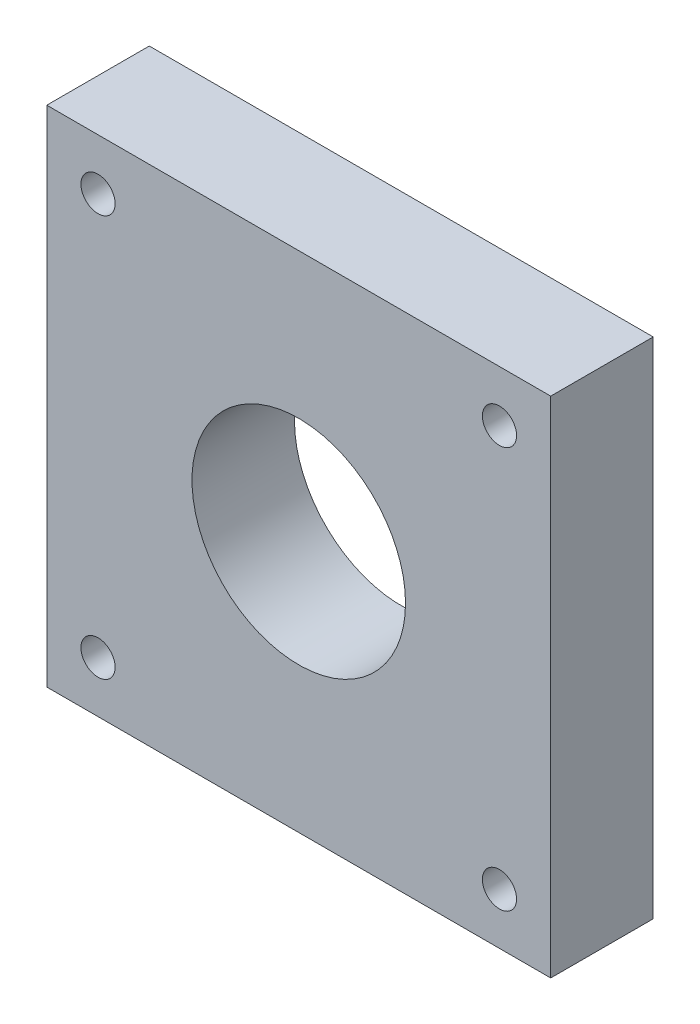
from build123d import *

# Parameters (mm, degrees)
SKETCH1_W               = 59
SKETCH1_H               = 59
BOSS_EXTRUDE1_DEPTH     = 12
CUT_EXTRUDE1_REACH      = 45.411
SKETCH2_R               = 2
MIRROR2_COPY_1_REACH    = 45.411
MIRROR2_COPY_1_SKETCH_R = 2
CUT_EXTRUDE2_REACH      = 45.411
SKETCH3_R               = 12.5


with BuildPart() as part:
    # Sketch1 → Boss-Extrude1 (new body)
    with BuildSketch(Plane.XY):
        Rectangle(SKETCH1_W, SKETCH1_H)
    extrude(amount=BOSS_EXTRUDE1_DEPTH)

    # Sketch2 → Cut-Extrude1 (cut, up to next)
    with BuildSketch(Plane.XY.offset(12), mode=Mode.PRIVATE) as cut_extrude1_sk1:
        with Locations((-23.5, 23.5)):
            Circle(SKETCH2_R)
    cut_extrude1_tool1 = extrude(cut_extrude1_sk1.sketch, amount=-CUT_EXTRUDE1_REACH, mode=Mode.PRIVATE) & part.part
    cut_extrude1 = cut_extrude1_tool1.solids().sort_by_distance((-23.5, 23.5, 12))[0]
    add(cut_extrude1, mode=Mode.SUBTRACT)

    # Mirror1: Cut-Extrude1 across plane
    add(cut_extrude1.mirror(Plane(origin=(0, 0, 0), x_dir=(0, 0, 1), z_dir=(1, 0, 0))), mode=Mode.SUBTRACT)

    # Mirror2: Cut-Extrude1 across plane
    add(cut_extrude1.mirror(Plane.ZX), mode=Mode.SUBTRACT)

    # Mirror2 copy 1 sketch → Mirror2 copy 1 (cut, up to next)
    with BuildSketch(Plane(origin=(0, 0, 12), x_dir=(-1, 0, 0), z_dir=(0, 0, 1)), mode=Mode.PRIVATE) as mirror2_copy_1_sk1:
        with Locations((-23.5, 23.5)):
            Circle(MIRROR2_COPY_1_SKETCH_R)
    mirror2_copy_1_tool1 = extrude(mirror2_copy_1_sk1.sketch, amount=-MIRROR2_COPY_1_REACH, mode=Mode.PRIVATE) & part.part
    add(mirror2_copy_1_tool1.solids().sort_by_distance((23.5, -23.5, 12))[0], mode=Mode.SUBTRACT)

    # Sketch3 → Cut-Extrude2 (cut, up to next)
    with BuildSketch(Plane.XY.offset(12), mode=Mode.PRIVATE) as cut_extrude2_sk1:
        Circle(SKETCH3_R)
    cut_extrude2_tool1 = extrude(cut_extrude2_sk1.sketch, amount=-CUT_EXTRUDE2_REACH, mode=Mode.PRIVATE) & part.part
    add(cut_extrude2_tool1.solids().sort_by_distance((0, 0, 12))[0], mode=Mode.SUBTRACT)


solid = part.part
